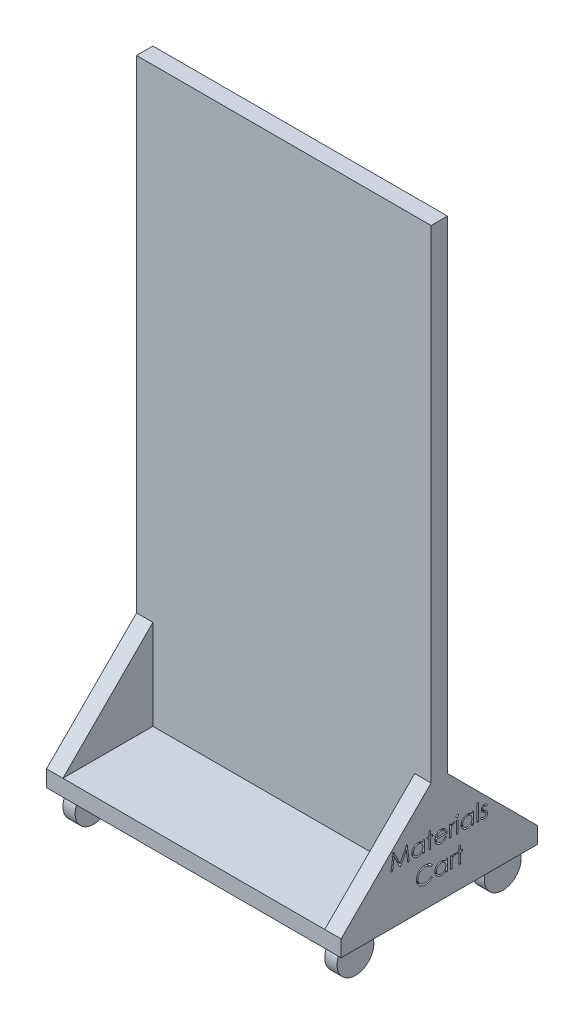
from build123d import *

# Parameters (mm, degrees)
SKETCH1_W           = 914.4
SKETCH1_H           = 609.6
BOSS_EXTRUDE1_DEPTH = 50.8
SKETCH3_W           = 914.4
SKETCH3_H           = 1828.8
BOSS_EXTRUDE2_DEPTH = 25.4
BOSS_EXTRUDE3_DEPTH = 50.8
SKETCH5_R           = 57.15
BOSS_EXTRUDE4_DEPTH = 19.05
SKETCH6_W           = 4.558974359
SKETCH6_H           = 37.123076923
SKETCH6_H_2         = 52.102564103
CUT_EXTRUDE1_DEPTH  = 12.7


with BuildPart() as part:
    # Sketch1 → Boss-Extrude1 (new body)
    with BuildSketch(Plane(origin=(0, 0, 0), x_dir=(1, 0, 0), z_dir=(0, 1, 0))):
        Rectangle(SKETCH1_W, SKETCH1_H)
    extrude(amount=BOSS_EXTRUDE1_DEPTH)

    # Sketch3 → Boss-Extrude2 (add, symmetric)
    with BuildSketch(Plane.XY):
        with Locations((0, 914.4)):
            Rectangle(SKETCH3_W, SKETCH3_H)
    extrude(amount=BOSS_EXTRUDE2_DEPTH, both=True)

    # Sketch4 → Boss-Extrude3 (add)
    with BuildSketch(Plane(origin=(457.2, 0, 0), x_dir=(0, 0, -1), z_dir=(1, 0, 0))):
        Polygon((304.8, 0), (304.8, 50.8), (25.4, 330.2), (-25.4, 330.2), (-304.8, 50.8), (-304.8, 0), align=None)
    boss_extrude3 = extrude(amount=-BOSS_EXTRUDE3_DEPTH)

    # Mirror1: Boss-Extrude3 across plane
    add(boss_extrude3.mirror(Plane(origin=(0, 0, 0), x_dir=(0, 0, 1), z_dir=(1, 0, 0))))

    # Sketch5 → Boss-Extrude4 (add, symmetric)
    with BuildSketch(Plane(origin=(406.4, 0, 0), x_dir=(0, 0, -1), z_dir=(1, 0, 0))):
        with Locations((-228.6, -44.45)):
            Circle(SKETCH5_R)
        with Locations((228.6, -44.45)):
            Circle(SKETCH5_R)
    boss_extrude4 = extrude(amount=BOSS_EXTRUDE4_DEPTH, both=True)

    # Mirror2: Boss-Extrude4 across plane
    add(boss_extrude4.mirror(Plane(origin=(0, 0, 0), x_dir=(0, 0, 1), z_dir=(1, 0, 0))))

    # Sketch6 → Cut-Extrude1 (cut)
    # profile 1 of 14: a face of its own
    with BuildSketch(Plane(origin=(457.2, 0, 0), x_dir=(0, 0, -1), z_dir=(1, 0, 0))):
        Polygon((-149.794871795, 152.4), (-143.088701923, 203.2), (-142.437419872, 203.2), (-121.464102564, 161.517948718), (-100.541666667, 203.2), (-99.880208333, 203.2), (-93.133333333, 152.4), (-97.712660256, 152.4), (-102.576923077, 188.953205128), (-120.914583333, 152.4), (-121.942387821, 152.4), (-140.351282051, 189.034615385), (-145.20536859, 152.4), align=None)
    # profile 2 of 14: a face of its own
    with BuildSketch(Plane(origin=(457.2, 0, 0), x_dir=(0, 0, -1), z_dir=(1, 0, 0))):
        with BuildLine():
            Line((-46.241025641, 189.523076923), (-46.241025641, 152.4))
            Line((-46.241025641, 152.4), (-50.8, 152.4))
            Line((-50.8, 152.4), (-50.8, 158.821233974))
            add(Edge.make_bspline(
                [(-50.8, 158.821233974), (-51.314078447, 158.240087868), (-52.317309, 157.105973933), (-53.992854369, 155.624324115), (-55.768941066, 154.399633048), (-57.636948813, 153.4104857), (-59.595190745, 152.667469568), (-61.639325954, 152.139350459), (-63.770188282, 151.799805651), (-65.225279603, 151.765899962), (-65.962660256, 151.748717949)],
                knots=[0, 0, 0, 0, 1.074387032, 2.096679803, 3.090159297, 4.057316773, 5.018401886, 5.985159533, 6.978961417, 8, 8, 8, 8], degree=3))
            add(Edge.make_bspline(
                [(-65.962660256, 151.748717949), (-66.618240843, 151.766517866), (-67.911074789, 151.801620092), (-69.812868251, 152.073941527), (-71.643007186, 152.511265978), (-73.403220984, 153.11942746), (-75.082119552, 153.926143386), (-76.694077526, 154.891942071), (-78.230744027, 156.042066119), (-79.66869665, 157.356886645), (-80.99286397, 158.785019602), (-82.154896155, 160.308229254), (-83.123769429, 161.919928979), (-83.933958029, 163.599713041), (-84.558019257, 165.360512445), (-84.993065148, 167.196238196), (-85.265069346, 169.10471979), (-85.300157061, 170.40432201), (-85.317948718, 171.063301282)],
                knots=[0, 0, 0, 0, 1.033919861, 2.038935746, 3.024066025, 3.998881131, 4.97069526, 5.957263378, 6.95902576, 7.993208707, 9.027059324, 10.027763471, 11.009749337, 11.988697705, 12.965288445, 13.950418724, 14.960734635, 16, 16, 16, 16], degree=3))
            add(Edge.make_bspline(
                [(-85.317948718, 171.063301282), (-85.299762733, 171.70866018), (-85.263810023, 172.984499905), (-84.995974718, 174.860887865), (-84.545581792, 176.668181478), (-83.913515889, 178.400562254), (-83.103009799, 180.06012641), (-82.117082136, 181.648047687), (-80.955661698, 183.168700656), (-79.616683905, 184.586328748), (-78.166202098, 185.895816521), (-76.614498232, 187.033867809), (-75.000171749, 188.016729501), (-73.29818291, 188.795471385), (-71.533723217, 189.425523531), (-69.691084633, 189.861430611), (-67.77793372, 190.118294588), (-66.47904315, 190.155491279), (-65.820192308, 190.174358974)],
                knots=[0, 0, 0, 0, 1.020392517, 2.01726096, 2.990465484, 3.961182959, 4.928053699, 5.906110375, 6.912531644, 7.948652711, 8.985773172, 9.998621852, 10.987621588, 11.969261332, 12.953316658, 13.946091881, 14.958173133, 16, 16, 16, 16], degree=3))
            add(Edge.make_bspline(
                [(-65.820192308, 190.174358974), (-65.062548639, 190.153491038), (-63.576845163, 190.112569999), (-61.403650057, 189.772025271), (-59.347781635, 189.196701233), (-57.393369897, 188.414127262), (-55.547433081, 187.374197137), (-53.827446909, 186.06239656), (-52.215410751, 184.48699876), (-51.280976804, 183.276936309), (-50.8, 182.654086538)],
                knots=[0, 0, 0, 0, 1.038897134, 2.037228247, 3.008116434, 3.962042015, 4.918381754, 5.904844433, 6.921570401, 8, 8, 8, 8], degree=3))
            Line((-50.8, 182.654086538), (-50.8, 189.523076923))
            Line((-50.8, 189.523076923), (-46.241025641, 189.523076923))
        make_face()
        with BuildLine():
            add(Edge.make_bspline(
                [(-65.759134615, 185.615384615), (-66.425548434, 185.591673531), (-67.740943313, 185.544871621), (-69.671981972, 185.179496319), (-71.519845239, 184.57157135), (-73.275291117, 183.74016547), (-74.910589804, 182.694719807), (-76.372086512, 181.430215158), (-77.671734863, 179.98115221), (-78.764780527, 178.35407015), (-79.655819739, 176.609771), (-80.282358374, 174.786422013), (-80.695569165, 172.916909767), (-80.737784264, 171.648902785), (-80.758974359, 171.012419872)],
                knots=[0, 0, 0, 0, 1.031046209, 2.035121221, 3.029706178, 4.034933723, 5.034054252, 6.02443088, 7.017295772, 8.038157696, 9.050218397, 10.03989886, 11.016116709, 12, 12, 12, 12], degree=3))
            add(Edge.make_bspline(
                [(-80.758974359, 171.012419872), (-80.731906765, 170.379740602), (-80.677877672, 169.116861951), (-80.28961045, 167.244801008), (-79.638211144, 165.42102234), (-78.749326348, 163.661005635), (-77.636274767, 162.026927835), (-76.346119467, 160.550242628), (-74.866383955, 159.280393746), (-73.227321852, 158.217402678), (-71.47678331, 157.358700946), (-69.635879391, 156.761211093), (-67.739215843, 156.375453591), (-66.449587683, 156.330394327), (-65.799839744, 156.307692308)],
                knots=[0, 0, 0, 0, 0.979072187, 1.954306742, 2.945804271, 3.96968567, 4.997920485, 5.998718438, 6.996577872, 8.005894225, 9.015743152, 10.005417472, 10.995077863, 12, 12, 12, 12], degree=3))
            add(Edge.make_bspline(
                [(-65.799839744, 156.307692308), (-65.140216218, 156.331785498), (-63.828290448, 156.379704465), (-61.891522916, 156.746643973), (-60.011996028, 157.352888246), (-58.215312827, 158.193252714), (-56.541581552, 159.23475948), (-55.039383786, 160.454062401), (-53.769152016, 161.87215433), (-52.692299283, 163.430646849), (-51.847924663, 165.139152397), (-51.232866433, 166.958288652), (-50.869226886, 168.888118939), (-50.823394696, 170.206943936), (-50.8, 170.880128205)],
                knots=[0, 0, 0, 0, 1.01762866, 2.023962475, 3.030623092, 4.058876274, 5.077231937, 6.066672613, 7.034107872, 8.005628644, 8.981990164, 9.965428785, 10.961468474, 12, 12, 12, 12], degree=3))
            add(Edge.make_bspline(
                [(-50.8, 170.880128205), (-50.813928727, 171.393031574), (-50.841344869, 172.402587715), (-51.050794278, 173.884895684), (-51.383968639, 175.303430908), (-51.853450192, 176.659684795), (-52.470180834, 177.946158732), (-53.214005551, 179.172089881), (-54.09800465, 180.331102206), (-55.107947782, 181.407235922), (-56.213431293, 182.388785717), (-57.383203483, 183.264929553), (-58.631123581, 183.984675169), (-59.936205146, 184.58035991), (-61.300712514, 185.054384143), (-62.735748939, 185.370616955), (-64.226061092, 185.587755329), (-65.242729554, 185.606077884), (-65.759134615, 185.615384615)],
                knots=[0, 0, 0, 0, 1.050140795, 2.067009409, 3.05949893, 4.030605086, 5.00011959, 5.97591094, 6.962425594, 7.979863591, 8.993523472, 9.986985069, 10.967611495, 11.937549037, 12.921786183, 13.919465291, 14.943216303, 16, 16, 16, 16], degree=3))
        make_face(mode=Mode.SUBTRACT)
    # profile 3 of 14: a face of its own
    with BuildSketch(Plane(origin=(457.2, 0, 0), x_dir=(0, 0, -1), z_dir=(1, 0, 0))):
        Polygon((-31.261538462, 204.502564103), (-26.702564103, 204.502564103), (-26.702564103, 189.523076923), (-20.18974359, 189.523076923), (-20.18974359, 184.964102564), (-26.702564103, 184.964102564), (-26.702564103, 152.4), (-31.261538462, 152.4), (-31.261538462, 184.964102564), (-37.774358974, 184.964102564), (-37.774358974, 189.523076923), (-31.261538462, 189.523076923), align=None)
    # profile 4 of 14: a face of its own
    with BuildSketch(Plane(origin=(457.2, 0, 0), x_dir=(0, 0, -1), z_dir=(1, 0, 0))):
        with BuildLine():
            Line((18.093429487, 164.123076923), (22.143589744, 161.996233974))
            add(Edge.make_bspline(
                [(22.143589744, 161.996233974), (21.820841447, 161.423742195), (21.192901072, 160.309899902), (20.11302736, 158.779631756), (18.981028135, 157.402984909), (17.745804828, 156.216737355), (16.444313488, 155.182574396), (15.06933667, 154.277785398), (13.613716115, 153.506808017), (12.077382967, 152.857257041), (10.447435196, 152.357827812), (8.719922901, 152.005069405), (6.891536625, 151.787017392), (5.6382835, 151.76168792), (4.996554487, 151.748717949)],
                knots=[0, 0, 0, 0, 1.120438281, 2.179929193, 3.190490725, 4.156257408, 5.095198341, 6.022838206, 6.959905092, 7.901321166, 8.864066838, 9.862729781, 10.905609505, 12, 12, 12, 12], degree=3))
            add(Edge.make_bspline(
                [(4.996554487, 151.748717949), (4.283293785, 151.765368379), (2.891928787, 151.797848545), (0.866609029, 152.077864886), (-1.040269387, 152.534663693), (-2.828599253, 153.172792123), (-4.49400109, 154.006308713), (-6.039784926, 155.02172062), (-7.474079758, 156.213811631), (-8.75168828, 157.59290744), (-9.901856635, 159.06874842), (-10.916779965, 160.6066224), (-11.765247821, 162.202660058), (-12.455439992, 163.846700807), (-13.012859175, 165.528382462), (-13.401358761, 167.263006049), (-13.625310532, 169.045876814), (-13.65962877, 170.251975287), (-13.676923077, 170.859775641)],
                knots=[0, 0, 0, 0, 1.145258523, 2.234067595, 3.276747158, 4.290159414, 5.277019952, 6.260822364, 7.254936242, 8.264827045, 9.274100331, 10.257902744, 11.220704747, 12.172965371, 13.118907548, 14.062713208, 15.023725156, 16, 16, 16, 16], degree=3))
            add(Edge.make_bspline(
                [(-13.676923077, 170.859775641), (-13.661550397, 171.430112037), (-13.631083776, 172.560443456), (-13.439048347, 174.233440502), (-13.098713122, 175.85945347), (-12.631696763, 177.439833458), (-12.028610104, 178.971934374), (-11.290816751, 180.456688669), (-10.417167382, 181.892516413), (-9.742649717, 182.798253325), (-9.402884615, 183.254487179)],
                knots=[0, 0, 0, 0, 1.024358464, 2.0301432, 3.019427413, 4.004406732, 4.986367066, 5.972626655, 6.978780325, 8, 8, 8, 8], degree=3))
            add(Edge.make_bspline(
                [(-9.402884615, 183.254487179), (-8.942670248, 183.80412678), (-8.036819937, 184.885994792), (-6.504744837, 186.307499635), (-4.84575913, 187.498306429), (-3.080653243, 188.485381433), (-1.188912419, 189.23538751), (0.804033862, 189.79429756), (2.920878371, 190.107486977), (4.368028433, 190.151724105), (5.10849359, 190.174358974)],
                knots=[0, 0, 0, 0, 1.030682036, 2.02871468, 2.997146059, 3.962720338, 4.930598197, 5.918074684, 6.934738563, 8, 8, 8, 8], degree=3))
            add(Edge.make_bspline(
                [(5.10849359, 190.174358974), (5.869733118, 190.154705922), (7.363111545, 190.116151113), (9.540720616, 189.758717474), (11.601179016, 189.191897539), (13.543662221, 188.391379665), (15.368367172, 187.358549599), (17.063433263, 186.079233729), (18.657849502, 184.592708348), (19.585436875, 183.449516623), (20.057451923, 182.867788462)],
                knots=[0, 0, 0, 0, 1.056321875, 2.072262726, 3.055038591, 4.01806755, 4.982017516, 5.957941055, 6.960871419, 8, 8, 8, 8], degree=3))
            add(Edge.make_bspline(
                [(20.057451923, 182.867788462), (20.378608628, 182.429405052), (21.018784322, 181.555556243), (21.820656517, 180.13067202), (22.51672385, 178.639901108), (23.073099398, 177.059145939), (23.523615587, 175.407136032), (23.84956027, 173.672061383), (24.040707877, 171.85443867), (24.07828097, 170.615984665), (24.097435897, 169.984615385)],
                knots=[0, 0, 0, 0, 0.94817472, 1.890038105, 2.849395472, 3.817997239, 4.812318967, 5.836947057, 6.897266129, 8, 8, 8, 8], degree=3))
            Line((24.097435897, 169.984615385), (-9.117948718, 169.984615385))
            add(Edge.make_bspline(
                [(-9.117948718, 169.984615385), (-9.09560243, 169.495477218), (-9.051659357, 168.533606741), (-8.846788136, 167.126145089), (-8.523863077, 165.785412008), (-8.070014968, 164.521463856), (-7.520404757, 163.317792291), (-6.84714921, 162.183326155), (-6.043935113, 161.12323277), (-5.148030676, 160.128029744), (-4.150796264, 159.241776411), (-3.101663818, 158.448544916), (-1.985608646, 157.783709397), (-0.811430749, 157.244069855), (0.418971161, 156.821612467), (1.705984736, 156.533245242), (3.047077396, 156.34010209), (3.961270336, 156.318625807), (4.426682692, 156.307692308)],
                knots=[0, 0, 0, 0, 1.094153842, 2.151609401, 3.174256925, 4.172055639, 5.149267565, 6.128595816, 7.11444997, 8.118368179, 9.117203808, 10.09244225, 11.054858984, 12.015122123, 12.976791628, 13.957293641, 14.960065497, 16, 16, 16, 16], degree=3))
            add(Edge.make_bspline(
                [(4.426682692, 156.307692308), (4.881722206, 156.316517816), (5.784607892, 156.334029317), (7.129223764, 156.504309624), (8.452048904, 156.779649624), (9.747608319, 157.155424337), (10.989608025, 157.613739791), (12.13980058, 158.166775553), (13.197604853, 158.77854902), (14.186273968, 159.478278018), (15.145247243, 160.334739704), (16.096549617, 161.403509597), (17.116565043, 162.667522857), (17.755042561, 163.618871381), (18.093429487, 164.123076923)],
                knots=[0, 0, 0, 0, 0.99110716, 1.966546729, 2.947904876, 3.932708344, 4.903319531, 5.828989031, 6.710028674, 7.56322171, 8.463672341, 9.504779593, 10.677557249, 12, 12, 12, 12], degree=3))
        make_face()
        with BuildLine():
            add(Edge.make_bspline(
                [(19.538461538, 174.543589744), (19.371596245, 175.148296597), (19.050434269, 176.312162632), (18.379346465, 177.923841842), (17.623565246, 179.356226234), (16.729169831, 180.598353479), (15.715800899, 181.701490182), (14.545293676, 182.665508504), (13.232681279, 183.527910365), (11.784748609, 184.255838072), (10.251433557, 184.875450878), (8.646063685, 185.290923987), (7.008013506, 185.575542487), (5.900075865, 185.602047146), (5.342548077, 185.615384615)],
                knots=[0, 0, 0, 0, 1.154881502, 2.222775134, 3.210006277, 4.132804581, 5.035138423, 5.962687519, 6.919655026, 7.923214229, 8.944639381, 9.960483929, 10.97369054, 12, 12, 12, 12], degree=3))
            add(Edge.make_bspline(
                [(5.342548077, 185.615384615), (4.887533369, 185.60650664), (3.988064954, 185.588956749), (2.662895165, 185.422476014), (1.390286963, 185.147287409), (0.160850217, 184.77042461), (-1.009304101, 184.268105465), (-2.144245308, 183.679068919), (-3.215115059, 182.960008217), (-3.884823005, 182.41196541), (-4.223157051, 182.135096154)],
                knots=[0, 0, 0, 0, 1.04873581, 2.073130211, 3.073294108, 4.04793562, 5.032784715, 6.005352987, 6.992311501, 8, 8, 8, 8], degree=3))
            add(Edge.make_bspline(
                [(-4.223157051, 182.135096154), (-4.465448115, 181.916012944), (-4.955786178, 181.472641923), (-5.610968604, 180.708766582), (-6.238282893, 179.885058194), (-6.809182767, 178.970003243), (-7.332823165, 177.97402165), (-7.82282512, 176.905514259), (-8.263862186, 175.756372825), (-8.512000012, 174.955584279), (-8.639663462, 174.543589744)],
                knots=[0, 0, 0, 0, 0.879870761, 1.780643979, 2.707998968, 3.669668524, 4.684282772, 5.740141944, 6.837334558, 8, 8, 8, 8], degree=3))
            Line((-8.639663462, 174.543589744), (19.538461538, 174.543589744))
        make_face(mode=Mode.SUBTRACT)
    # profile 5 of 14: a face of its own
    with BuildSketch(Plane(origin=(457.2, 0, 0), x_dir=(0, 0, -1), z_dir=(1, 0, 0))):
        with BuildLine():
            Line((31.912820513, 189.523076923), (36.471794872, 189.523076923))
            Line((36.471794872, 189.523076923), (36.471794872, 184.058413462))
            add(Edge.make_bspline(
                [(36.471794872, 184.058413462), (36.808363142, 184.56722377), (37.452047343, 185.540319531), (38.52193786, 186.8272911), (39.617814783, 187.892858062), (40.744924358, 188.741994849), (41.911555066, 189.377910973), (43.092102822, 189.843718453), (44.30514107, 190.119160629), (45.120291285, 190.155934879), (45.528685897, 190.174358974)],
                knots=[0, 0, 0, 0, 1.2804753, 2.448899062, 3.506932113, 4.484331642, 5.4025378, 6.288909075, 7.142734305, 8, 8, 8, 8], degree=3))
            add(Edge.make_bspline(
                [(45.528685897, 190.174358974), (45.845479436, 190.157079331), (46.49730273, 190.121525342), (47.484021462, 189.871722516), (48.500652135, 189.472898646), (49.155861642, 189.097846271), (49.497435897, 188.902323718)],
                knots=[0, 0, 0, 0, 0.901110191, 1.854092781, 2.881294221, 4, 4, 4, 4], degree=3))
            Line((49.497435897, 188.902323718), (46.994070513, 184.953926282))
            add(Edge.make_bspline(
                [(46.994070513, 184.953926282), (46.774773863, 185.05175643), (46.358506841, 185.23745678), (45.749566279, 185.457232241), (45.188134306, 185.586640391), (44.830450659, 185.60624509), (44.663701923, 185.615384615)],
                knots=[0, 0, 0, 0, 1.180555205, 2.24091978, 3.179933427, 4, 4, 4, 4], degree=3))
            add(Edge.make_bspline(
                [(44.663701923, 185.615384615), (44.297858705, 185.591000073), (43.551644588, 185.541262675), (42.456040997, 185.150265122), (41.392910128, 184.518527351), (40.548590001, 183.817906642), (39.894833873, 183.14229861), (39.428341457, 182.552316082), (39.000420444, 181.890774801), (38.591549816, 181.168983962), (38.219021889, 180.37461934), (37.871336976, 179.515617271), (37.556974051, 178.59098283), (37.377719078, 177.946802251), (37.285897436, 177.616826923)],
                knots=[0, 0, 0, 0, 1.125678352, 2.296057538, 3.5422874, 4.923748041, 5.663163013, 6.437101912, 7.23742474, 8.08941207, 8.991984279, 9.93940061, 10.944477711, 12, 12, 12, 12], degree=3))
            add(Edge.make_bspline(
                [(37.285897436, 177.616826923), (37.217210126, 177.322518232), (37.065072956, 176.670646846), (36.917150063, 175.57701683), (36.770998203, 174.284902012), (36.667995856, 172.790705749), (36.572520273, 171.09815942), (36.51867108, 169.204684552), (36.473631211, 167.108337627), (36.472425555, 165.642767015), (36.471794872, 164.876121795)],
                knots=[0, 0, 0, 0, 0.566838948, 1.255505196, 2.06880316, 3.007127437, 4.065329342, 5.249902469, 6.561414163, 8, 8, 8, 8], degree=3))
            Line((36.471794872, 164.876121795), (36.471794872, 152.4))
            Line((36.471794872, 152.4), (31.912820513, 152.4))
            Line((31.912820513, 152.4), (31.912820513, 189.523076923))
        make_face()
    # profile 6 of 14: a face of its own
    with BuildSketch(Plane(origin=(457.2, 0, 0), x_dir=(0, 0, -1), z_dir=(1, 0, 0))):
        with BuildLine():
            add(Edge.make_bspline(
                [(55.664262821, 205.153846154), (55.947165347, 205.140723028), (56.501142828, 205.115025426), (57.302233685, 204.894967416), (58.031678317, 204.521954839), (58.678692269, 204.021506899), (59.233891081, 203.432960691), (59.622593963, 202.747001494), (59.872419598, 202.005921822), (59.902588343, 201.488994242), (59.917948718, 201.225801282)],
                knots=[0, 0, 0, 0, 1.055194115, 2.066272739, 3.074728998, 4.095836921, 5.109056067, 6.073838105, 7.019297344, 8, 8, 8, 8], degree=3))
            add(Edge.make_bspline(
                [(59.917948718, 201.225801282), (59.902241941, 200.969440488), (59.871191502, 200.462645536), (59.62278693, 199.734413427), (59.230578449, 199.057985541), (58.679048283, 198.47058209), (58.03158398, 197.970410806), (57.302258746, 197.597324881), (56.501136236, 197.377286316), (55.947163118, 197.351586034), (55.664262821, 197.338461538)],
                knots=[0, 0, 0, 0, 0.96129708, 1.900370562, 2.859976407, 3.87933698, 4.906634145, 5.921202961, 6.938410037, 8, 8, 8, 8], degree=3))
            add(Edge.make_bspline(
                [(55.664262821, 197.338461538), (55.38459757, 197.351084906), (54.840265697, 197.375654642), (54.051169814, 197.601642328), (53.327944883, 197.970538475), (52.679669062, 198.467307104), (52.139299402, 199.061593041), (51.745986565, 199.734000621), (51.498155689, 200.462750636), (51.467027937, 200.969475793), (51.451282051, 201.225801282)],
                knots=[0, 0, 0, 0, 1.054934014, 2.053291228, 3.073705704, 4.106921865, 5.123545215, 6.088680038, 7.033164197, 8, 8, 8, 8], degree=3))
            add(Edge.make_bspline(
                [(51.451282051, 201.225801282), (51.466682966, 201.488957613), (51.496931333, 202.005813252), (51.746172333, 202.747421159), (52.136023257, 203.429324099), (52.680026865, 204.024779919), (53.32784966, 204.521827944), (54.051194418, 204.89065019), (54.840259198, 205.116657059), (55.384595364, 205.141224147), (55.664262821, 205.153846154)],
                knots=[0, 0, 0, 0, 0.98631895, 1.937192651, 2.907499808, 3.917963147, 4.944918757, 5.95915025, 6.951458133, 8, 8, 8, 8], degree=3))
        make_face()
    # profile 7 of 14: a face of its own
    with BuildSketch(Plane(origin=(457.2, 0, 0), x_dir=(0, 0, -1), z_dir=(1, 0, 0))):
        with Locations((55.684615385, 170.961538462)):
            Rectangle(SKETCH6_W, SKETCH6_H)
    # profile 8 of 14: a face of its own
    with BuildSketch(Plane(origin=(457.2, 0, 0), x_dir=(0, 0, -1), z_dir=(1, 0, 0))):
        with BuildLine():
            Line((106.81025641, 189.523076923), (106.81025641, 152.4))
            Line((106.81025641, 152.4), (102.251282051, 152.4))
            Line((102.251282051, 152.4), (102.251282051, 158.821233974))
            add(Edge.make_bspline(
                [(102.251282051, 158.821233974), (101.737203604, 158.240087868), (100.733973051, 157.105973933), (99.058427682, 155.624324115), (97.282340985, 154.399633048), (95.414333239, 153.4104857), (93.456091307, 152.667469568), (91.411956097, 152.139350459), (89.281093769, 151.799805651), (87.826002448, 151.765899962), (87.088621795, 151.748717949)],
                knots=[0, 0, 0, 0, 1.074387032, 2.096679803, 3.090159297, 4.057316773, 5.018401886, 5.985159533, 6.978961417, 8, 8, 8, 8], degree=3))
            add(Edge.make_bspline(
                [(87.088621795, 151.748717949), (86.433041208, 151.766517866), (85.140207263, 151.801620092), (83.2384138, 152.073941527), (81.408274865, 152.511265978), (79.648061068, 153.11942746), (77.9691625, 153.926143386), (76.357204525, 154.891942071), (74.820538024, 156.042066119), (73.382585401, 157.356886645), (72.058418081, 158.785019602), (70.896385896, 160.308229254), (69.927512623, 161.919928979), (69.117324023, 163.599713041), (68.493262795, 165.360512445), (68.058216903, 167.196238196), (67.786212705, 169.10471979), (67.75112499, 170.40432201), (67.733333333, 171.063301282)],
                knots=[0, 0, 0, 0, 1.033919861, 2.038935746, 3.024066025, 3.998881131, 4.97069526, 5.957263378, 6.95902576, 7.993208707, 9.027059324, 10.027763471, 11.009749337, 11.988697705, 12.965288445, 13.950418724, 14.960734635, 16, 16, 16, 16], degree=3))
            add(Edge.make_bspline(
                [(67.733333333, 171.063301282), (67.751519318, 171.70866018), (67.787472029, 172.984499905), (68.055307334, 174.860887865), (68.505700259, 176.668181478), (69.137766163, 178.400562254), (69.948272252, 180.06012641), (70.934199915, 181.648047687), (72.095620353, 183.168700656), (73.434598147, 184.586328748), (74.885079954, 185.895816521), (76.436783819, 187.033867809), (78.051110303, 188.016729501), (79.753099141, 188.795471385), (81.517558834, 189.425523531), (83.360197418, 189.861430611), (85.273348331, 190.118294588), (86.572238902, 190.155491279), (87.231089744, 190.174358974)],
                knots=[0, 0, 0, 0, 1.020392517, 2.01726096, 2.990465484, 3.961182959, 4.928053699, 5.906110375, 6.912531644, 7.948652711, 8.985773172, 9.998621852, 10.987621588, 11.969261332, 12.953316658, 13.946091881, 14.958173133, 16, 16, 16, 16], degree=3))
            add(Edge.make_bspline(
                [(87.231089744, 190.174358974), (87.988733412, 190.153491038), (89.474436889, 190.112569999), (91.647631994, 189.772025271), (93.703500417, 189.196701233), (95.657912155, 188.414127262), (97.50384897, 187.374197137), (99.223835142, 186.06239656), (100.8358713, 184.48699876), (101.770305248, 183.276936309), (102.251282051, 182.654086538)],
                knots=[0, 0, 0, 0, 1.038897134, 2.037228247, 3.008116434, 3.962042015, 4.918381754, 5.904844433, 6.921570401, 8, 8, 8, 8], degree=3))
            Line((102.251282051, 182.654086538), (102.251282051, 189.523076923))
            Line((102.251282051, 189.523076923), (106.81025641, 189.523076923))
        make_face()
        with BuildLine():
            add(Edge.make_bspline(
                [(87.292147436, 185.615384615), (86.625733618, 185.591673531), (85.310338738, 185.544871621), (83.37930008, 185.179496319), (81.531436812, 184.57157135), (79.775990934, 183.74016547), (78.140692247, 182.694719807), (76.679195539, 181.430215158), (75.379547188, 179.98115221), (74.286501524, 178.35407015), (73.395462312, 176.609771), (72.768923677, 174.786422013), (72.355712886, 172.916909767), (72.313497788, 171.648902785), (72.292307692, 171.012419872)],
                knots=[0, 0, 0, 0, 1.031046209, 2.035121221, 3.029706178, 4.034933723, 5.034054252, 6.02443088, 7.017295772, 8.038157696, 9.050218397, 10.03989886, 11.016116709, 12, 12, 12, 12], degree=3))
            add(Edge.make_bspline(
                [(72.292307692, 171.012419872), (72.319375287, 170.379740602), (72.373404379, 169.116861951), (72.761671601, 167.244801008), (73.413070907, 165.42102234), (74.301955703, 163.661005635), (75.415007285, 162.026927835), (76.705162585, 160.550242628), (78.184898096, 159.280393746), (79.823960199, 158.217402678), (81.574498741, 157.358700946), (83.41540266, 156.761211093), (85.312066209, 156.375453591), (86.601694368, 156.330394327), (87.251442308, 156.307692308)],
                knots=[0, 0, 0, 0, 0.979072187, 1.954306742, 2.945804271, 3.96968567, 4.997920485, 5.998718438, 6.996577872, 8.005894225, 9.015743152, 10.005417472, 10.995077863, 12, 12, 12, 12], degree=3))
            add(Edge.make_bspline(
                [(87.251442308, 156.307692308), (87.911065833, 156.331785498), (89.222991604, 156.379704465), (91.159759135, 156.746643973), (93.039286024, 157.352888246), (94.835969224, 158.193252714), (96.509700499, 159.23475948), (98.011898266, 160.454062401), (99.282130035, 161.87215433), (100.358982769, 163.430646849), (101.203357388, 165.139152397), (101.818415619, 166.958288652), (102.182055165, 168.888118939), (102.227887356, 170.206943936), (102.251282051, 170.880128205)],
                knots=[0, 0, 0, 0, 1.01762866, 2.023962475, 3.030623092, 4.058876274, 5.077231937, 6.066672613, 7.034107872, 8.005628644, 8.981990164, 9.965428785, 10.961468474, 12, 12, 12, 12], degree=3))
            add(Edge.make_bspline(
                [(102.251282051, 170.880128205), (102.237353325, 171.393031574), (102.209937182, 172.402587715), (102.000487773, 173.884895684), (101.667313413, 175.303430908), (101.197831859, 176.659684795), (100.581101217, 177.946158732), (99.837276501, 179.172089881), (98.953277402, 180.331102206), (97.94333427, 181.407235922), (96.837850758, 182.388785717), (95.668078569, 183.264929553), (94.42015847, 183.984675169), (93.115076906, 184.58035991), (91.750569537, 185.054384143), (90.315533112, 185.370616955), (88.825220959, 185.587755329), (87.808552498, 185.606077884), (87.292147436, 185.615384615)],
                knots=[0, 0, 0, 0, 1.050140795, 2.067009409, 3.05949893, 4.030605086, 5.00011959, 5.97591094, 6.962425594, 7.979863591, 8.993523472, 9.986985069, 10.967611495, 11.937549037, 12.921786183, 13.919465291, 14.943216303, 16, 16, 16, 16], degree=3))
        make_face(mode=Mode.SUBTRACT)
    # profile 9 of 14: a face of its own
    with BuildSketch(Plane(origin=(457.2, 0, 0), x_dir=(0, 0, -1), z_dir=(1, 0, 0))):
        with Locations((118.858974359, 178.451282052)):
            Rectangle(SKETCH6_W, SKETCH6_H_2)
    # profile 10 of 14: a face of its own
    with BuildSketch(Plane(origin=(457.2, 0, 0), x_dir=(0, 0, -1), z_dir=(1, 0, 0))):
        with BuildLine():
            Line((149.143589744, 184.89286859), (146.05, 181.707692308))
            add(Edge.make_bspline(
                [(146.05, 181.707692308), (145.783074977, 182.017037403), (145.268474957, 182.613418329), (144.452315176, 183.410790609), (143.639172587, 184.080435323), (142.840178378, 184.645799538), (142.035241216, 185.073232866), (141.23380709, 185.385215433), (140.435046199, 185.578281641), (139.901123174, 185.603165494), (139.638942308, 185.615384615)],
                knots=[0, 0, 0, 0, 1.26578478, 2.440284043, 3.530471711, 4.527705817, 5.468200915, 6.346673037, 7.188140097, 8, 8, 8, 8], degree=3))
            add(Edge.make_bspline(
                [(139.638942308, 185.615384615), (139.317604878, 185.599783602), (138.685258294, 185.569083015), (137.77919213, 185.262636655), (136.938080201, 184.792246965), (136.210087463, 184.12504581), (135.593409136, 183.359210136), (135.143267709, 182.502920621), (134.867990003, 181.582017587), (134.833087035, 180.942955652), (134.815384615, 180.618830128)],
                knots=[0, 0, 0, 0, 0.99966794, 1.967205029, 2.953328237, 3.988086729, 5.028030931, 6.008226631, 6.989793394, 8, 8, 8, 8], degree=3))
            add(Edge.make_bspline(
                [(134.815384615, 180.618830128), (134.831507262, 180.325466745), (134.863707106, 179.739566965), (135.114030335, 178.875269788), (135.512680754, 178.032613348), (135.885265289, 177.516443164), (136.07724359, 177.250480769)],
                knots=[0, 0, 0, 0, 0.960159726, 1.917612774, 2.927026955, 4, 4, 4, 4], degree=3))
            add(Edge.make_bspline(
                [(136.07724359, 177.250480769), (136.192828014, 177.108464517), (136.438834892, 176.806200822), (136.900512767, 176.386682035), (137.423353665, 175.923063078), (138.052111619, 175.459522702), (138.759697966, 174.971382233), (139.56145672, 174.47786556), (140.431943821, 173.941353336), (141.055148157, 173.6010741), (141.379086538, 173.424198718)],
                knots=[0, 0, 0, 0, 0.66740084, 1.420478572, 2.27185888, 3.217733974, 4.268547843, 5.408967954, 6.65319498, 8, 8, 8, 8], degree=3))
            add(Edge.make_bspline(
                [(141.379086538, 173.424198718), (141.774072172, 173.202929843), (142.537054354, 172.775511236), (143.621166519, 172.112067539), (144.605046999, 171.452662867), (145.497032118, 170.804349291), (146.279958944, 170.14898767), (146.977581594, 169.51169794), (147.57249958, 168.873224551), (147.90565943, 168.427155359), (148.064903846, 168.213942308)],
                knots=[0, 0, 0, 0, 1.27191281, 2.456916733, 3.569705269, 4.599008579, 5.553216877, 6.436649441, 7.252746552, 8, 8, 8, 8], degree=3))
            add(Edge.make_bspline(
                [(148.064903846, 168.213942308), (148.329216644, 167.78336023), (148.855248167, 166.92642198), (149.40763672, 165.515365948), (149.727825852, 164.018790655), (149.772271791, 162.99506586), (149.794871795, 162.474519231)],
                knots=[0, 0, 0, 0, 0.995354457, 1.980940102, 2.973342416, 4, 4, 4, 4], degree=3))
            add(Edge.make_bspline(
                [(149.794871795, 162.474519231), (149.784428275, 162.107755622), (149.76384818, 161.385007866), (149.62076538, 160.320605195), (149.374676009, 159.302652189), (149.039486666, 158.320103485), (148.586867768, 157.391785161), (148.056402598, 156.494276176), (147.419589593, 155.646991238), (146.692549055, 154.851042902), (145.896505886, 154.124084053), (145.047331078, 153.485107809), (144.143978908, 152.954257429), (143.19290419, 152.514977561), (142.191946011, 152.165643988), (141.140947869, 151.923799249), (140.043250517, 151.779051745), (139.296783588, 151.758957062), (138.916426282, 151.748717949)],
                knots=[0, 0, 0, 0, 1.032770009, 2.035186124, 3.017557409, 3.978232242, 4.952395191, 5.920591857, 6.910227898, 7.931268572, 8.952309245, 9.941945286, 10.918353717, 11.897095711, 12.887975737, 13.898235213, 14.929059601, 16, 16, 16, 16], degree=3))
            add(Edge.make_bspline(
                [(138.916426282, 151.748717949), (138.403096993, 151.763126285), (137.383571082, 151.791742755), (135.875686015, 152.060345014), (134.402184718, 152.478289589), (132.974217905, 153.054738005), (131.623720023, 153.78263978), (130.38810546, 154.654402521), (129.263081948, 155.641228769), (128.622736718, 156.397610444), (128.302564103, 156.775801282)],
                knots=[0, 0, 0, 0, 1.013940152, 2.01379169, 3.017749504, 4.037548394, 5.051665909, 6.043208538, 7.021604269, 8, 8, 8, 8], degree=3))
            Line((128.302564103, 156.775801282), (131.324919872, 160.215384615))
            add(Edge.make_bspline(
                [(131.324919872, 160.215384615), (131.611902323, 159.905435462), (132.168261197, 159.304552162), (133.058004573, 158.504461732), (133.963397023, 157.833883282), (134.875397617, 157.273001719), (135.807506414, 156.84083301), (136.754499901, 156.537214561), (137.714451884, 156.342081714), (138.359207456, 156.319174074), (138.682371795, 156.307692308)],
                knots=[0, 0, 0, 0, 1.179806542, 2.287233372, 3.337373186, 4.324005949, 5.273901747, 6.200048787, 7.097828587, 8, 8, 8, 8], degree=3))
            add(Edge.make_bspline(
                [(138.682371795, 156.307692308), (139.122414834, 156.327588851), (139.982185118, 156.36646336), (141.213631672, 156.719408582), (142.350660878, 157.272837597), (143.337971151, 158.057838359), (144.17837966, 158.971593527), (144.786937163, 160.000861315), (145.168317081, 161.115434458), (145.213108147, 161.888063308), (145.235897436, 162.281169872)],
                knots=[0, 0, 0, 0, 1.072336372, 2.095165389, 3.102688358, 4.141489647, 5.156069229, 6.117746104, 7.042326257, 8, 8, 8, 8], degree=3))
            add(Edge.make_bspline(
                [(145.235897436, 162.281169872), (145.220130649, 162.604978051), (145.18900124, 163.244293956), (144.944533178, 164.16958462), (144.558266637, 165.047253037), (144.177924883, 165.560908489), (143.984214744, 165.822516026)],
                knots=[0, 0, 0, 0, 1.013901739, 2.00181326, 2.98231254, 4, 4, 4, 4], degree=3))
            add(Edge.make_bspline(
                [(143.984214744, 165.822516026), (143.867775419, 165.953657853), (143.614128516, 166.239332118), (143.148869585, 166.651901834), (142.591784271, 167.096591959), (141.936607049, 167.565861878), (141.182017144, 168.053521635), (140.324956187, 168.557012805), (139.37716531, 169.100249511), (138.707031576, 169.46048908), (138.356730769, 169.648798077)],
                knots=[0, 0, 0, 0, 0.615000592, 1.339693406, 2.178160186, 3.116406724, 4.166410947, 5.330106347, 6.604359322, 8, 8, 8, 8], degree=3))
            add(Edge.make_bspline(
                [(138.356730769, 169.648798077), (137.978682394, 169.859823188), (137.245525944, 170.269068224), (136.207068122, 170.906478761), (135.27020938, 171.554792347), (134.412406755, 172.177641557), (133.655327016, 172.807865543), (133.00195268, 173.446163936), (132.426559719, 174.066794591), (132.108008715, 174.506538211), (131.955849359, 174.716586538)],
                knots=[0, 0, 0, 0, 1.262093308, 2.447601706, 3.550203992, 4.582594899, 5.537233252, 6.418365656, 7.244515135, 8, 8, 8, 8], degree=3))
            add(Edge.make_bspline(
                [(131.955849359, 174.716586538), (131.692696655, 175.139614322), (131.166299287, 175.985817721), (130.655175941, 177.398209783), (130.303842722, 178.885126616), (130.272457173, 179.911095816), (130.256410256, 180.435657051)],
                knots=[0, 0, 0, 0, 0.985009483, 1.970363186, 2.962279964, 4, 4, 4, 4], degree=3))
            add(Edge.make_bspline(
                [(130.256410256, 180.435657051), (130.26416372, 180.778562827), (130.279338347, 181.449678013), (130.400446295, 182.435761462), (130.620943132, 183.372631809), (130.897511723, 184.274358849), (131.281893616, 185.123474957), (131.741211325, 185.931303394), (132.280960235, 186.696727575), (132.902799999, 187.407973035), (133.586519308, 188.053994114), (134.325220537, 188.617128486), (135.10229009, 189.097643578), (135.921018008, 189.500635052), (136.789269444, 189.805455119), (137.700975394, 190.015293737), (138.654290442, 190.155432109), (139.305998213, 190.167959161), (139.638942308, 190.174358974)],
                knots=[0, 0, 0, 0, 1.087655834, 2.128696564, 3.144119009, 4.137814668, 5.115653402, 6.093965665, 7.082169637, 8.081268856, 9.086088321, 10.061021666, 11.022561449, 11.980240094, 12.950172527, 13.934149372, 14.944599409, 16, 16, 16, 16], degree=3))
            add(Edge.make_bspline(
                [(139.638942308, 190.174358974), (140.033615686, 190.158330258), (140.830366105, 190.125972143), (142.025684678, 189.868986691), (143.2192429, 189.446140494), (144.414107523, 188.862140307), (145.601525437, 188.106426795), (146.791941528, 187.193052964), (147.999646654, 186.12802785), (148.753755427, 185.313787664), (149.143589744, 184.89286859)],
                knots=[0, 0, 0, 0, 0.845714091, 1.707292901, 2.609013841, 3.555613372, 4.552488639, 5.621697636, 6.770543573, 8, 8, 8, 8], degree=3))
        make_face()
    # profile 11 of 14: a face of its own
    with BuildSketch(Plane(origin=(457.2, 0, 0), x_dir=(0, 0, -1), z_dir=(1, 0, 0))):
        with BuildLine():
            Line((-21.492307692, 108.211858974), (-25.481410256, 105.158974359))
            add(Edge.make_bspline(
                [(-25.481410256, 105.158974359), (-25.765975722, 105.498114721), (-26.331270093, 106.171823098), (-27.240723661, 107.117857629), (-28.188530363, 108.004176281), (-29.174327894, 108.835001276), (-30.215860257, 109.581278905), (-31.287896992, 110.281899485), (-32.408371477, 110.909899795), (-33.957796654, 111.671362565), (-35.984685423, 112.465963901), (-38.536221945, 113.132216515), (-41.19975446, 113.556341008), (-43.016908191, 113.602276421), (-43.941185897, 113.625641026)],
                knots=[0, 0, 0, 0, 0.757959112, 1.505699292, 2.245454638, 2.979532153, 3.711538275, 4.438200793, 5.171680507, 5.909471876, 7.393775596, 8.890124382, 10.418191784, 12, 12, 12, 12], degree=3))
            add(Edge.make_bspline(
                [(-43.941185897, 113.625641026), (-44.450394928, 113.619777798), (-45.464087049, 113.60810576), (-46.968470607, 113.454121886), (-48.444762892, 113.237696323), (-49.892003602, 112.91656306), (-51.308350543, 112.510560474), (-52.703063121, 112.025414467), (-54.055948398, 111.425178505), (-55.385721684, 110.761755761), (-56.659774232, 110.012420277), (-57.865258926, 109.195072198), (-58.997779146, 108.318857884), (-60.058230774, 107.380493255), (-61.047697909, 106.384204228), (-61.959010878, 105.319373213), (-62.789016261, 104.189404523), (-63.554166225, 103.009198494), (-64.239425326, 101.782192832), (-64.81317329, 100.503846095), (-65.321247635, 99.1960494), (-65.723282357, 97.844026837), (-66.041501058, 96.457291836), (-66.261068285, 95.032122685), (-66.413300953, 93.571496707), (-66.424914949, 92.581487255), (-66.430769231, 92.082451923)],
                knots=[0, 0, 0, 0, 1.054917814, 2.100044995, 3.131103042, 4.146048494, 5.169673617, 6.183595914, 7.203665975, 8.234915748, 9.262203917, 10.264457458, 11.251630812, 12.227803204, 13.197192746, 14.159520551, 15.12972552, 16.100847026, 17.073214652, 18.039054194, 19.002613845, 19.979014051, 20.95965708, 21.949030935, 22.966165397, 24, 24, 24, 24], degree=3))
            add(Edge.make_bspline(
                [(-66.430769231, 92.082451923), (-66.412454829, 91.331608765), (-66.37649693, 89.85742782), (-66.05648111, 87.698128672), (-65.570178642, 85.629542893), (-64.841335411, 83.664601182), (-63.94262462, 81.779074156), (-62.80701803, 80.004864512), (-61.491783716, 78.315161233), (-59.978315, 76.749897877), (-58.317796299, 75.320041521), (-56.536198039, 74.060918796), (-54.63795752, 73.01131993), (-52.644033859, 72.137909049), (-50.539083405, 71.466525688), (-48.326891416, 70.993880695), (-46.012269313, 70.685565618), (-44.430656309, 70.656048088), (-43.625721154, 70.641025641)],
                knots=[0, 0, 0, 0, 1.029171465, 2.020641659, 2.987623507, 3.938342917, 4.889210282, 5.84687017, 6.821220943, 7.821438502, 8.827599549, 9.822697543, 10.807740252, 11.797342354, 12.80366471, 13.83203677, 14.896651826, 16, 16, 16, 16], degree=3))
            add(Edge.make_bspline(
                [(-43.625721154, 70.641025641), (-42.738859268, 70.665537073), (-40.993302921, 70.713781434), (-38.433446996, 71.122492822), (-35.982916455, 71.785184886), (-33.641579485, 72.712617587), (-31.41603662, 73.918250909), (-29.302805093, 75.379808672), (-27.300101155, 77.111193616), (-26.095832259, 78.433200164), (-25.481410256, 79.107692308)],
                knots=[0, 0, 0, 0, 1.028121516, 2.023589091, 2.998037872, 3.967518031, 4.937445131, 5.927275754, 6.942489185, 8, 8, 8, 8], degree=3))
            Line((-25.481410256, 79.107692308), (-21.492307692, 76.085336538))
            add(Edge.make_bspline(
                [(-21.492307692, 76.085336538), (-21.813336259, 75.671121293), (-22.453855682, 74.844674871), (-23.491017758, 73.679588341), (-24.58361396, 72.583701197), (-25.739759694, 71.565848866), (-26.946155069, 70.605664051), (-28.224461774, 69.730426043), (-29.55787516, 68.927918351), (-30.941877311, 68.193104704), (-32.374997748, 67.541162947), (-33.855519261, 66.983033975), (-35.377060185, 66.502249864), (-36.939690079, 66.106707468), (-38.546650206, 65.797972879), (-40.192141659, 65.591584456), (-41.879715848, 65.450187526), (-43.018237046, 65.437300062), (-43.595192308, 65.430769231)],
                knots=[0, 0, 0, 0, 0.986787822, 1.968848986, 2.935600012, 3.899624008, 4.868462664, 5.837806735, 6.815139263, 7.798259679, 8.787526145, 9.778297419, 10.776456485, 11.791383307, 12.812564526, 13.85620153, 14.913611965, 16, 16, 16, 16], degree=3))
            add(Edge.make_bspline(
                [(-43.595192308, 65.430769231), (-44.141563247, 65.434571866), (-45.22194412, 65.442091105), (-46.817046001, 65.563897421), (-48.369923345, 65.730082173), (-49.876137915, 65.980310361), (-51.34390921, 66.275593926), (-52.759931407, 66.671416736), (-54.13813846, 67.114816068), (-55.472993234, 67.635951305), (-56.765631162, 68.224014754), (-58.011883053, 68.888646523), (-59.211175729, 69.624257587), (-60.375300123, 70.414633167), (-61.487059338, 71.285160863), (-62.556087649, 72.223750872), (-63.588379589, 73.227239714), (-64.227047131, 73.9508473), (-64.548157051, 74.314663462)],
                knots=[0, 0, 0, 0, 1.114604814, 2.203992996, 3.262667896, 4.300477797, 5.318619304, 6.316056647, 7.298880507, 8.271930387, 9.238335007, 10.195173496, 11.151986948, 12.108099108, 13.064862484, 14.031167946, 15.010108607, 16, 16, 16, 16], degree=3))
            add(Edge.make_bspline(
                [(-64.548157051, 74.314663462), (-65.062480106, 74.946632718), (-66.084916855, 76.202941543), (-67.393026776, 78.239092357), (-68.512768435, 80.364973789), (-69.41811037, 82.591754469), (-70.125866612, 84.91443769), (-70.616176529, 87.334194299), (-70.934788388, 89.848764431), (-70.971223437, 91.55908125), (-70.98974359, 92.428445513)],
                knots=[0, 0, 0, 0, 0.994628077, 1.977248131, 2.950237994, 3.925870899, 4.908910175, 5.911660606, 6.938484602, 8, 8, 8, 8], degree=3))
            add(Edge.make_bspline(
                [(-70.98974359, 92.428445513), (-70.967171066, 93.342198953), (-70.922761035, 95.139951801), (-70.545450632, 97.778270894), (-69.938480676, 100.305954055), (-69.076377264, 102.71828269), (-67.98337388, 105.027945043), (-66.633159028, 107.217297388), (-65.041418792, 109.300341223), (-63.220636952, 111.245469613), (-61.223945343, 113.024040789), (-59.085717987, 114.588770832), (-56.810140014, 115.890956492), (-54.422280909, 116.979472221), (-51.90426016, 117.816140429), (-49.261450117, 118.40183811), (-46.498816725, 118.766395112), (-44.613956375, 118.812480987), (-43.65625, 118.835897436)],
                knots=[0, 0, 0, 0, 1.032925535, 2.032216505, 3.007276963, 3.968222605, 4.92396291, 5.891752235, 6.871517503, 7.883894988, 8.900124299, 9.891468569, 10.874487609, 11.85992873, 12.854644235, 13.869047385, 14.917252991, 16, 16, 16, 16], degree=3))
            add(Edge.make_bspline(
                [(-43.65625, 118.835897436), (-43.072565664, 118.828899544), (-41.917221304, 118.815047923), (-40.208125663, 118.679975917), (-38.544174175, 118.454807004), (-36.924220493, 118.148322334), (-35.340383663, 117.767941782), (-33.804768738, 117.272419738), (-32.30836494, 116.705832369), (-30.860609816, 116.053292349), (-29.468449603, 115.320803646), (-28.132317894, 114.516485452), (-26.862827945, 113.641334904), (-25.651046944, 112.702795101), (-24.517245938, 111.681010297), (-23.429233621, 110.60408519), (-22.423958544, 109.440999971), (-21.803426456, 108.622322644), (-21.492307692, 108.211858974)],
                knots=[0, 0, 0, 0, 1.096760587, 2.17092713, 3.219439832, 4.250915756, 5.268269357, 6.278326846, 7.281116186, 8.274029601, 9.260640565, 10.235837813, 11.203064059, 12.156899882, 13.114053108, 14.069676657, 15.032185724, 16, 16, 16, 16], degree=3))
        make_face()
    # profile 12 of 14: a face of its own
    with BuildSketch(Plane(origin=(457.2, 0, 0), x_dir=(0, 0, -1), z_dir=(1, 0, 0))):
        with BuildLine():
            Line((25.4, 103.856410256), (25.4, 66.733333333))
            Line((25.4, 66.733333333), (20.841025641, 66.733333333))
            Line((20.841025641, 66.733333333), (20.841025641, 73.154567308))
            add(Edge.make_bspline(
                [(20.841025641, 73.154567308), (20.326947194, 72.573421201), (19.323716641, 71.439307266), (17.648171272, 69.957657449), (15.872084575, 68.732966382), (14.004076828, 67.743819034), (12.045834897, 67.000802902), (10.001699687, 66.472683792), (7.870837359, 66.133138985), (6.415746038, 66.099233296), (5.678365385, 66.082051282)],
                knots=[0, 0, 0, 0, 1.074387032, 2.096679803, 3.090159297, 4.057316773, 5.018401886, 5.985159533, 6.978961417, 8, 8, 8, 8], degree=3))
            add(Edge.make_bspline(
                [(5.678365385, 66.082051282), (5.022784798, 66.0998512), (3.729950852, 66.134953425), (1.82815739, 66.40727486), (-0.001981545, 66.844599312), (-1.762195343, 67.452760793), (-3.441093911, 68.259476719), (-5.053051885, 69.225275405), (-6.589718386, 70.375399453), (-8.027671009, 71.690219979), (-9.351838329, 73.118352935), (-10.513870514, 74.641562587), (-11.482743788, 76.253262312), (-12.292932388, 77.933046374), (-12.916993616, 79.693845778), (-13.352039507, 81.52957153), (-13.624043705, 83.438053123), (-13.65913142, 84.737655344), (-13.676923077, 85.396634615)],
                knots=[0, 0, 0, 0, 1.033919861, 2.038935746, 3.024066025, 3.998881131, 4.97069526, 5.957263378, 6.95902576, 7.993208707, 9.027059324, 10.027763471, 11.009749337, 11.988697705, 12.965288445, 13.950418724, 14.960734635, 16, 16, 16, 16], degree=3))
            add(Edge.make_bspline(
                [(-13.676923077, 85.396634615), (-13.658737092, 86.041993513), (-13.622784382, 87.317833239), (-13.354949077, 89.194221198), (-12.904556151, 91.001514811), (-12.272490248, 92.733895587), (-11.461984158, 94.393459743), (-10.476056495, 95.981381021), (-9.314636057, 97.50203399), (-7.975658264, 98.919662082), (-6.525176457, 100.229149855), (-4.973472591, 101.367201143), (-3.359146108, 102.350062834), (-1.657157269, 103.128804719), (0.107302424, 103.758856865), (1.949941008, 104.194763945), (3.863091921, 104.451627921), (5.161982491, 104.488824613), (5.820833333, 104.507692308)],
                knots=[0, 0, 0, 0, 1.020392517, 2.01726096, 2.990465484, 3.961182959, 4.928053699, 5.906110375, 6.912531644, 7.948652711, 8.985773172, 9.998621852, 10.987621588, 11.969261332, 12.953316658, 13.946091881, 14.958173133, 16, 16, 16, 16], degree=3))
            add(Edge.make_bspline(
                [(5.820833333, 104.507692308), (6.578477002, 104.486824371), (8.064180478, 104.445903332), (10.237375584, 104.105358604), (12.293244006, 103.530034567), (14.247655744, 102.747460595), (16.09359256, 101.70753047), (17.813578732, 100.395729893), (19.42561489, 98.820332094), (20.360048837, 97.610269643), (20.841025641, 96.987419872)],
                knots=[0, 0, 0, 0, 1.038897134, 2.037228247, 3.008116434, 3.962042015, 4.918381754, 5.904844433, 6.921570401, 8, 8, 8, 8], degree=3))
            Line((20.841025641, 96.987419872), (20.841025641, 103.856410256))
            Line((20.841025641, 103.856410256), (25.4, 103.856410256))
        make_face()
        with BuildLine():
            add(Edge.make_bspline(
                [(5.881891026, 99.948717949), (5.215477207, 99.925006864), (3.900082328, 99.878204954), (1.969043669, 99.512829652), (0.121180402, 98.904904683), (-1.634265476, 98.073498803), (-3.269564163, 97.02805314), (-4.731060871, 95.763548491), (-6.030709222, 94.314485543), (-7.123754886, 92.687403484), (-8.014794098, 90.943104333), (-8.641332733, 89.119755346), (-9.054543524, 87.2502431), (-9.096758623, 85.982236118), (-9.117948718, 85.345753205)],
                knots=[0, 0, 0, 0, 1.031046209, 2.035121221, 3.029706178, 4.034933723, 5.034054252, 6.02443088, 7.017295772, 8.038157696, 9.050218397, 10.03989886, 11.016116709, 12, 12, 12, 12], degree=3))
            add(Edge.make_bspline(
                [(-9.117948718, 85.345753205), (-9.090881124, 84.713073935), (-9.036852031, 83.450195284), (-8.648584809, 81.578134341), (-7.997185503, 79.754355674), (-7.108300707, 77.994338968), (-5.995249125, 76.360261168), (-4.705093826, 74.883575961), (-3.225358314, 73.61372708), (-1.586296211, 72.550736011), (0.164242331, 71.692034279), (2.00514625, 71.094544426), (3.901809798, 70.708786924), (5.191437958, 70.663727661), (5.841185897, 70.641025641)],
                knots=[0, 0, 0, 0, 0.979072187, 1.954306742, 2.945804271, 3.96968567, 4.997920485, 5.998718438, 6.996577872, 8.005894225, 9.015743152, 10.005417472, 10.995077863, 12, 12, 12, 12], degree=3))
            add(Edge.make_bspline(
                [(5.841185897, 70.641025641), (6.500809423, 70.665118832), (7.812735193, 70.713037798), (9.749502725, 71.079977306), (11.629029613, 71.686221579), (13.425712814, 72.526586047), (15.099444089, 73.568092813), (16.601641855, 74.787395734), (17.871873625, 76.205487664), (18.948726358, 77.763980182), (19.793100978, 79.472485731), (20.408159208, 81.291621985), (20.771798755, 83.221452272), (20.817630945, 84.540277269), (20.841025641, 85.213461538)],
                knots=[0, 0, 0, 0, 1.01762866, 2.023962475, 3.030623092, 4.058876274, 5.077231937, 6.066672613, 7.034107872, 8.005628644, 8.981990164, 9.965428785, 10.961468474, 12, 12, 12, 12], degree=3))
            add(Edge.make_bspline(
                [(20.841025641, 85.213461538), (20.827096914, 85.726364907), (20.799680772, 86.735921048), (20.590231363, 88.218229018), (20.257057002, 89.636764241), (19.787575449, 90.993018128), (19.170844807, 92.279492066), (18.42702009, 93.505423214), (17.543020991, 94.664435539), (16.533077859, 95.740569255), (15.427594348, 96.72211905), (14.257822158, 97.598262887), (13.00990206, 98.318008503), (11.704820495, 98.913693243), (10.340313127, 99.387717476), (8.905276702, 99.703950288), (7.414964549, 99.921088662), (6.398296088, 99.939411217), (5.881891026, 99.948717949)],
                knots=[0, 0, 0, 0, 1.050140795, 2.067009409, 3.05949893, 4.030605086, 5.00011959, 5.97591094, 6.962425594, 7.979863591, 8.993523472, 9.986985069, 10.967611495, 11.937549037, 12.921786183, 13.919465291, 14.943216303, 16, 16, 16, 16], degree=3))
        make_face(mode=Mode.SUBTRACT)
    # profile 13 of 14: a face of its own
    with BuildSketch(Plane(origin=(457.2, 0, 0), x_dir=(0, 0, -1), z_dir=(1, 0, 0))):
        with BuildLine():
            Line((34.517948718, 103.856410256), (39.076923077, 103.856410256))
            Line((39.076923077, 103.856410256), (39.076923077, 98.391746795))
            add(Edge.make_bspline(
                [(39.076923077, 98.391746795), (39.413491347, 98.900557103), (40.057175548, 99.873652864), (41.127066065, 101.160624433), (42.222942988, 102.226191395), (43.350052564, 103.075328182), (44.516683271, 103.711244307), (45.697231027, 104.177051787), (46.910269275, 104.452493962), (47.72541949, 104.489268212), (48.133814103, 104.507692308)],
                knots=[0, 0, 0, 0, 1.2804753, 2.448899062, 3.506932113, 4.484331642, 5.4025378, 6.288909075, 7.142734305, 8, 8, 8, 8], degree=3))
            add(Edge.make_bspline(
                [(48.133814103, 104.507692308), (48.450607641, 104.490412665), (49.102430935, 104.454858676), (50.089149667, 104.20505585), (51.105780341, 103.806231979), (51.760989847, 103.431179605), (52.102564103, 103.235657051)],
                knots=[0, 0, 0, 0, 0.901110191, 1.854092781, 2.881294221, 4, 4, 4, 4], degree=3))
            Line((52.102564103, 103.235657051), (49.599198718, 99.287259615))
            add(Edge.make_bspline(
                [(49.599198718, 99.287259615), (49.379902068, 99.385089764), (48.963635046, 99.570790113), (48.354694484, 99.790565574), (47.793262511, 99.919973724), (47.435578864, 99.939578423), (47.268830128, 99.948717949)],
                knots=[0, 0, 0, 0, 1.180555205, 2.24091978, 3.179933427, 4, 4, 4, 4], degree=3))
            add(Edge.make_bspline(
                [(47.268830128, 99.948717949), (46.90298691, 99.924333406), (46.156772793, 99.874596008), (45.061169202, 99.483598456), (43.998038333, 98.851860685), (43.153718206, 98.151239976), (42.499962078, 97.475631944), (42.033469662, 96.885649415), (41.605548649, 96.224108135), (41.196678022, 95.502317295), (40.824150094, 94.707952673), (40.476465181, 93.848950604), (40.162102256, 92.924316164), (39.982847283, 92.280135584), (39.891025641, 91.950160256)],
                knots=[0, 0, 0, 0, 1.125678352, 2.296057538, 3.5422874, 4.923748041, 5.663163013, 6.437101912, 7.23742474, 8.08941207, 8.991984279, 9.93940061, 10.944477711, 12, 12, 12, 12], degree=3))
            add(Edge.make_bspline(
                [(39.891025641, 91.950160256), (39.822338332, 91.655851566), (39.670201161, 91.00398018), (39.522278269, 89.910350164), (39.376126408, 88.618235345), (39.273124061, 87.124039083), (39.177648478, 85.431492754), (39.123799285, 83.538017886), (39.078759416, 81.441670961), (39.07755376, 79.976100348), (39.076923077, 79.209455128)],
                knots=[0, 0, 0, 0, 0.566838948, 1.255505196, 2.06880316, 3.007127437, 4.065329342, 5.249902469, 6.561414163, 8, 8, 8, 8], degree=3))
            Line((39.076923077, 79.209455128), (39.076923077, 66.733333333))
            Line((39.076923077, 66.733333333), (34.517948718, 66.733333333))
            Line((34.517948718, 66.733333333), (34.517948718, 103.856410256))
        make_face()
    # profile 14 of 14: a face of its own
    with BuildSketch(Plane(origin=(457.2, 0, 0), x_dir=(0, 0, -1), z_dir=(1, 0, 0))):
        Polygon((61.220512821, 118.835897436), (65.779487179, 118.835897436), (65.779487179, 103.856410256), (72.292307692, 103.856410256), (72.292307692, 99.297435897), (65.779487179, 99.297435897), (65.779487179, 66.733333333), (61.220512821, 66.733333333), (61.220512821, 99.297435897), (54.707692308, 99.297435897), (54.707692308, 103.856410256), (61.220512821, 103.856410256), align=None)
    extrude(amount=-CUT_EXTRUDE1_DEPTH, mode=Mode.SUBTRACT)


solid = part.part
